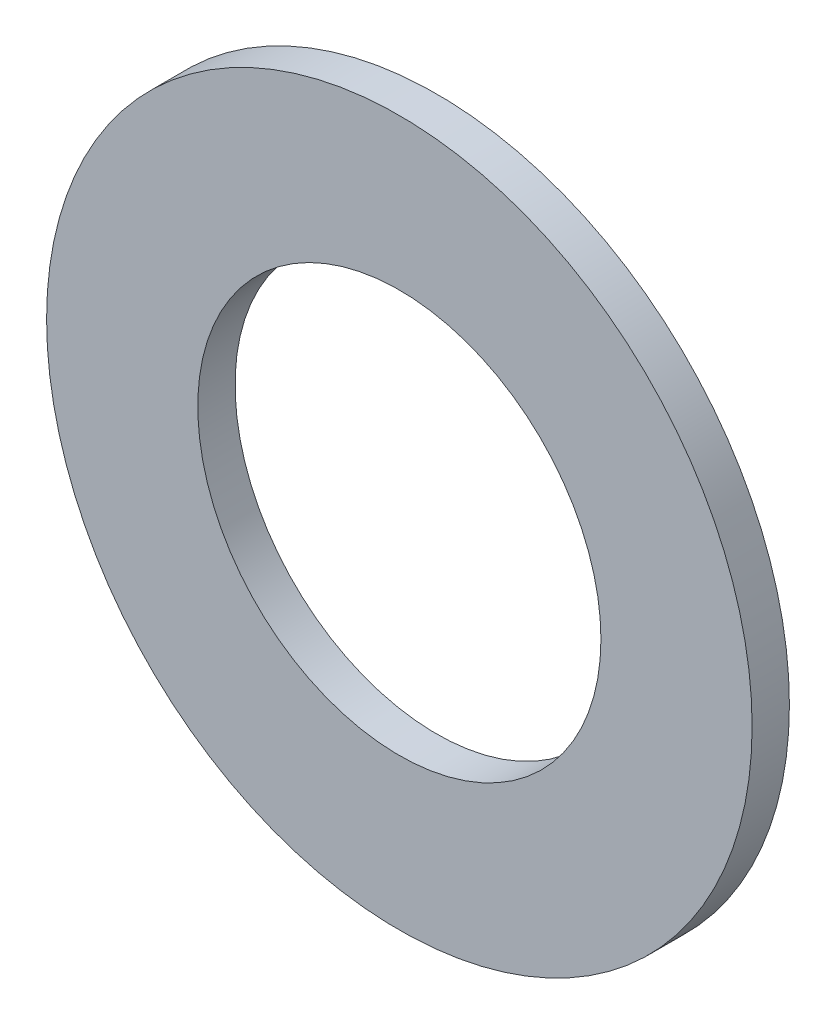
from build123d import *

# Parameters (mm, degrees)
SKETCH_1_R      = 17.5
SKETCH_1_R_2    = 10
EXTRUDE_1_DEPTH = 1.85


with BuildPart() as part:
    # 草图1 → 凸台-拉伸1 (new body)
    with BuildSketch(Plane.XY):
        Circle(SKETCH_1_R)
        Circle(SKETCH_1_R_2, mode=Mode.SUBTRACT)
    extrude(amount=EXTRUDE_1_DEPTH)


solid = part.part
